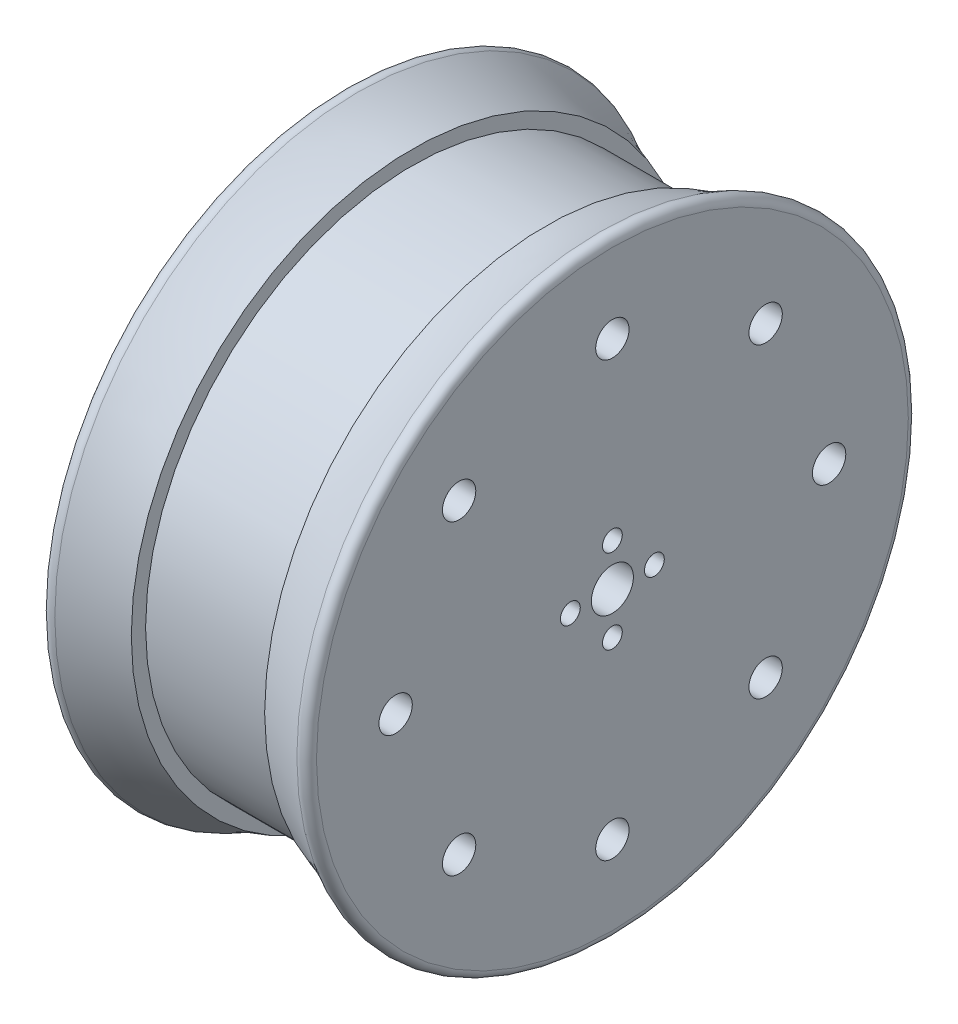
from build123d import *

# Parameters (mm, degrees)
FLOWER_R               = 4
FLOWER_R_2             = 1.885
MOUNTING_DEPTH         = 98.854112643
FILLET1_R              = 1.5875
SKETCH1_R              = 3.175
MASS_AND_BALANCE_DEPTH = 97.414821501


with BuildPart() as part:
    # Wheel Arc → Wheel (revolve)
    with BuildSketch(Plane.XY, mode=Mode.PRIVATE) as wheel_sk:
        with BuildLine():
            Line((-25.4, 0), (25.4, 0))
            Line((25.4, 0), (25.4, -59.138766309))
            ThreePointArc((25.4, -59.138766309), (19.25570916, -55.8663236), (12.7, -53.524557464))
            Line((12.7, -53.524557464), (12.7, -50.8))
            Line((12.7, -50.8), (-12.7, -50.8))
            Line((-12.7, -50.8), (-12.7, -53.524557464))
            ThreePointArc((-12.7, -53.524557464), (-19.25570916, -55.8663236), (-25.4, -59.138766309))
            Line((-25.4, -59.138766309), (-25.4, 0))
        make_face()
    revolve(wheel_sk.sketch.rotate(Axis((-40.905271883, 0, 0), (1, 0, 0)), 270), axis=Axis((-40.905271883, 0, 0), (1, 0, 0)))

    # Flower → Mounting (cut, through all)
    with BuildSketch(Plane(origin=(25.4, 0, 0), x_dir=(0, 0, -1), z_dir=(1, 0, 0))):
        Circle(FLOWER_R)
        with Locations((0, 8)):
            Circle(FLOWER_R_2)
        with Locations((8, 0)):
            Circle(FLOWER_R_2)
        with Locations((0, -8)):
            Circle(FLOWER_R_2)
        with Locations((-8, 0)):
            Circle(FLOWER_R_2)
    extrude(amount=-MOUNTING_DEPTH, mode=Mode.SUBTRACT)

    # Fillet1
    fillet1_edges = [part.edges().sort_by_distance(p)[0] for p in [
        (-25.4, 0, -59.138766309),
        (25.4, 0, -59.138766309),
    ]]
    fillet(fillet1_edges, radius=FILLET1_R)

    # Sketch1 → Mass_and_Balance (cut, through all)
    with BuildSketch(Plane(origin=(25.4, 0, 0), x_dir=(0, 0, -1), z_dir=(1, 0, 0))):
        with Locations((0, 41.275)):
            Circle(SKETCH1_R)
        with Locations((29.185832393, 29.185832393)):
            Circle(SKETCH1_R)
        with Locations((41.275, 0)):
            Circle(SKETCH1_R)
        with Locations((29.185832393, -29.185832393)):
            Circle(SKETCH1_R)
        with Locations((0, -41.275)):
            Circle(SKETCH1_R)
        with Locations((-29.185832393, -29.185832393)):
            Circle(SKETCH1_R)
        with Locations((-41.275, 0)):
            Circle(SKETCH1_R)
        with Locations((-29.185832393, 29.185832393)):
            Circle(SKETCH1_R)
    extrude(amount=-MASS_AND_BALANCE_DEPTH, mode=Mode.SUBTRACT)


solid = part.part
